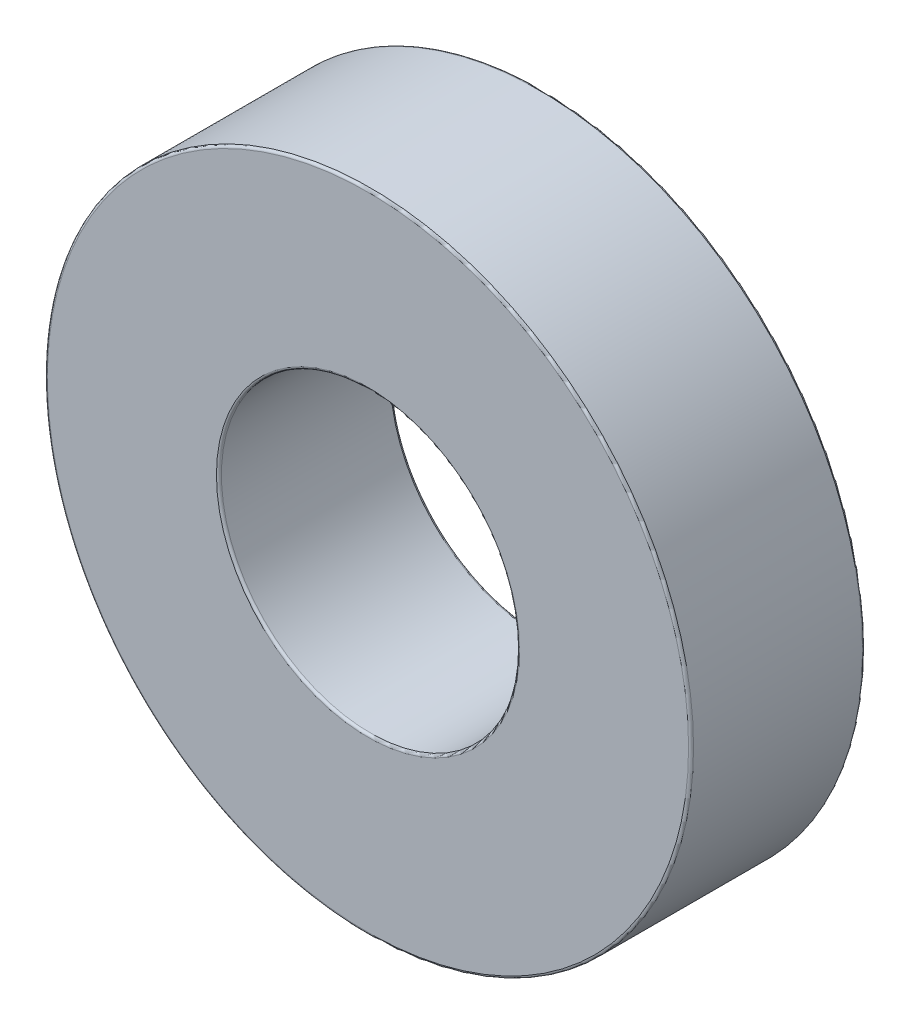
from build123d import *

# Parameters (mm, degrees)
SKETCH1_R           = 6.5
SKETCH1_R_2         = 3
BOSS_EXTRUDE1_DEPTH = 3.5
FILLET1_R           = 0.05


with BuildPart() as part:
    # Sketch1 → Boss-Extrude1 (new body)
    with BuildSketch(Plane.XY):
        Circle(SKETCH1_R)
        Circle(SKETCH1_R_2, mode=Mode.SUBTRACT)
    extrude(amount=BOSS_EXTRUDE1_DEPTH)

    # Fillet1
    fillet1_edges = [part.edges().sort_by_distance(p)[0] for p in [
        (-6.5, 0, 0),
        (-6.5, 0, 3.5),
        (-3, 0, 0),
        (-3, 0, 3.5),
    ]]
    fillet(fillet1_edges, radius=FILLET1_R)


solid = part.part
